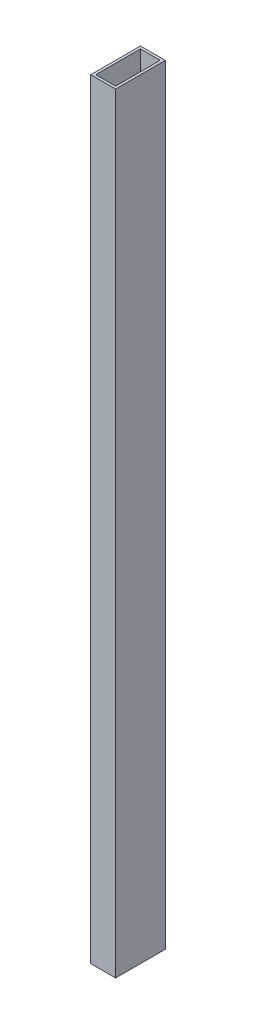
from build123d import *

# Parameters (mm, degrees)
SKETCH_1_W      = 20
SKETCH_1_H      = 40
SKETCH_1_W_2    = 16
SKETCH_1_H_2    = 36
EXTRUDE_1_DEPTH = 620


with BuildPart() as part:
    # Эскиз1 → Бобышка-Вытянуть1 (new body)
    with BuildSketch(Plane(origin=(0, 0, 0), x_dir=(1, 0, 0), z_dir=(0, 1, 0))):
        with Locations((-28.588165701, 11.886912651)):
            Rectangle(SKETCH_1_W, SKETCH_1_H)
        with Locations((-28.588165701, 11.886912651)):
            Rectangle(SKETCH_1_W_2, SKETCH_1_H_2, mode=Mode.SUBTRACT)
    extrude(amount=EXTRUDE_1_DEPTH)


solid = part.part
